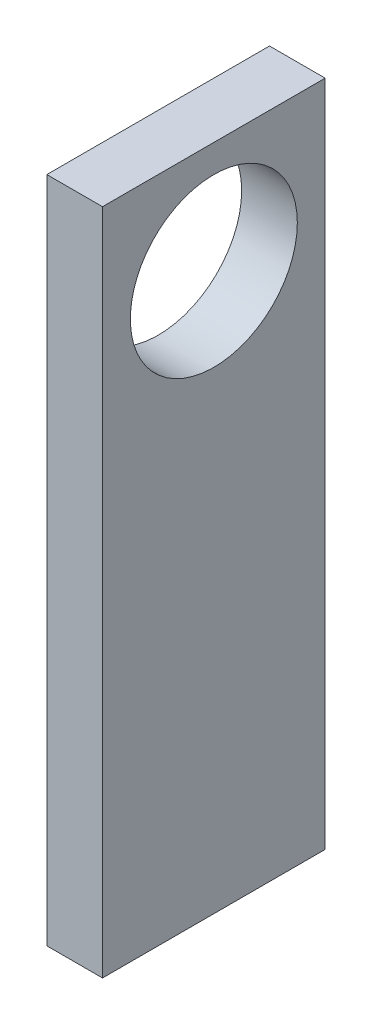
from build123d import *

# Parameters (mm, degrees)
SKETCH_1_R      = 7.5
EXTRUDE_1_DEPTH = 5


with BuildPart() as part:
    # 草图1 → 凸台-拉伸1 (new body)
    with BuildSketch(Plane(origin=(0, 0, 0), x_dir=(0, 0, -1), z_dir=(1, 0, 0))):
        Polygon((-10, -10), (-10, -50), (10, -50), (10, -10), (10, 10), (-10, 10), align=None)
        Circle(SKETCH_1_R, mode=Mode.SUBTRACT)
    extrude(amount=EXTRUDE_1_DEPTH)


solid = part.part
